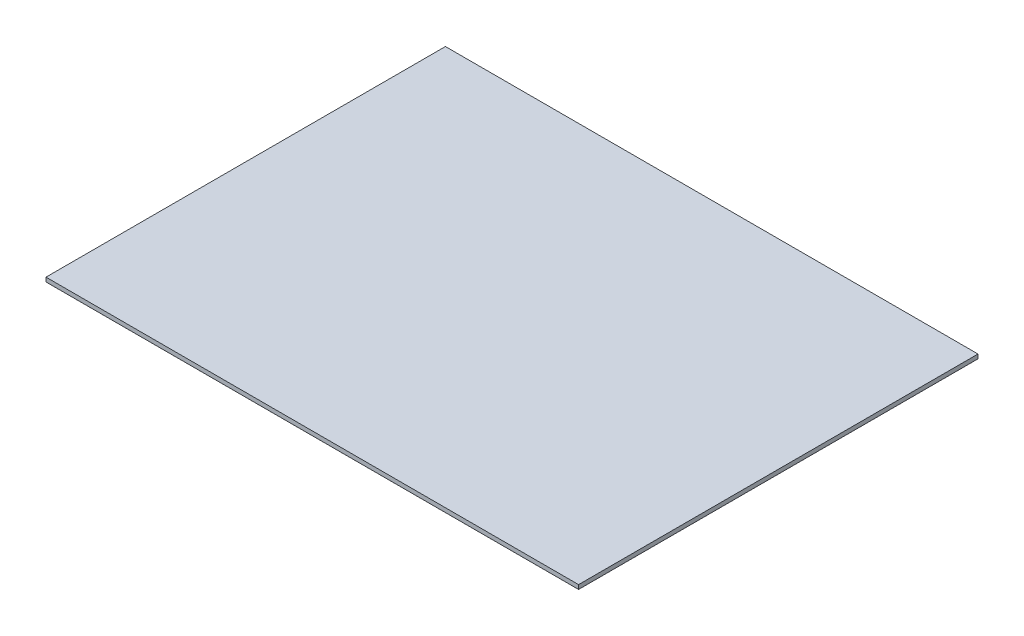
from build123d import *

# Parameters (mm, degrees)
SKETCH1_W           = 101.6
SKETCH1_H           = 76.2
BOSS_EXTRUDE1_DEPTH = 0.7874
SKETCH2_W           = 101.6
SKETCH2_H           = 76.2
BOSS_EXTRUDE2_DEPTH = 0.017399


with BuildPart() as part:
    # Sketch1 → Boss-Extrude1 (new body)
    with BuildSketch(Plane(origin=(0, 0, 0), x_dir=(1, 0, 0), z_dir=(0, 1, 0))):
        Rectangle(SKETCH1_W, SKETCH1_H)
    extrude(amount=BOSS_EXTRUDE1_DEPTH)


with BuildPart() as body_2:
    # Sketch2 → Boss-Extrude2 (new body)
    with BuildSketch(Plane.XZ):
        Rectangle(SKETCH2_W, SKETCH2_H)
    extrude(amount=BOSS_EXTRUDE2_DEPTH)


solid = Compound([part.part, body_2.part])
